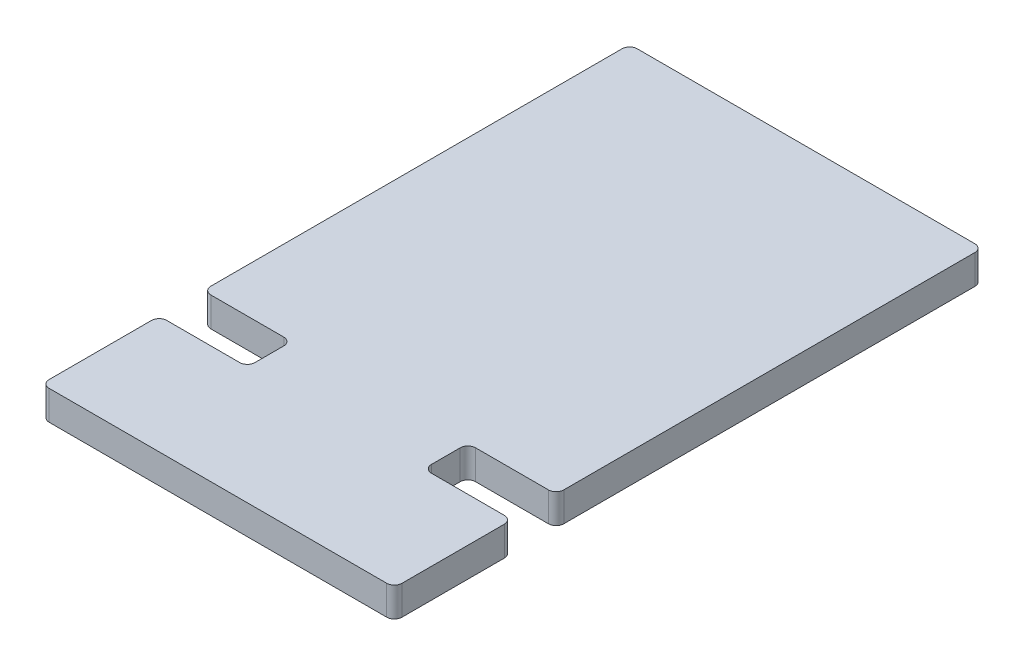
from build123d import *

# Parameters (mm, degrees)
SKETCH1_W            = 152.4
SKETCH1_H            = 254
BOSS_EXTRUDE1_DEPTH  = 12.7
SKETCH2_W            = 38.1
SKETCH2_H            = 19.05
CUT_EXTRUDE1_DEPTH   = 149.649688866
FILLET1_R            = 3.302
FILLET1_OF_MIRROR1_R = 3.302
FILLET2_R            = 3.302


with BuildPart() as part:
    # Sketch1 → Boss-Extrude1 (new body)
    with BuildSketch(Plane(origin=(0, 0, 0), x_dir=(1, 0, 0), z_dir=(0, 1, 0))):
        Rectangle(SKETCH1_W, SKETCH1_H)
    extrude(amount=BOSS_EXTRUDE1_DEPTH)

    # Sketch2 → Cut-Extrude1 (cut, through all)
    with BuildSketch(Plane(origin=(0, 12.7, 0), x_dir=(1, 0, 0), z_dir=(0, 1, 0))):
        with Locations((57.15, -66.675)):
            Rectangle(SKETCH2_W, SKETCH2_H)
    cut_extrude1 = extrude(amount=-CUT_EXTRUDE1_DEPTH, mode=Mode.SUBTRACT)

    # Fillet1
    fillet1_edges = [part.edges().sort_by_distance(p)[0] for p in [
        (38.1, 6.35, 76.2),
        (38.1, 6.35, 57.15),
    ]]
    fillet(fillet1_edges, radius=FILLET1_R)

    # Mirror1: Cut-Extrude1 across plane
    add(cut_extrude1.mirror(Plane(origin=(0, 0, 0), x_dir=(0, 0, 1), z_dir=(1, 0, 0))), mode=Mode.SUBTRACT)

    # Fillet1 of Mirror1
    fillet1_of_mirror1_edges = [part.edges().sort_by_distance(p)[0] for p in [
        (-38.1, 6.35, 76.2),
        (-38.1, 6.35, 57.15),
    ]]
    fillet(fillet1_of_mirror1_edges, radius=FILLET1_OF_MIRROR1_R)

    # Fillet2
    fillet2_edges = [part.edges().sort_by_distance(p)[0] for p in [
        (76.2, 6.35, 57.15),
        (76.2, 6.35, 76.2),
        (-76.2, 6.35, 76.2),
        (-76.2, 6.35, 57.15),
        (76.2, 6.35, 127),
        (-76.2, 6.35, 127),
        (-76.2, 6.35, -127),
        (76.2, 6.35, -127),
    ]]
    fillet(fillet2_edges, radius=FILLET2_R)


solid = part.part
